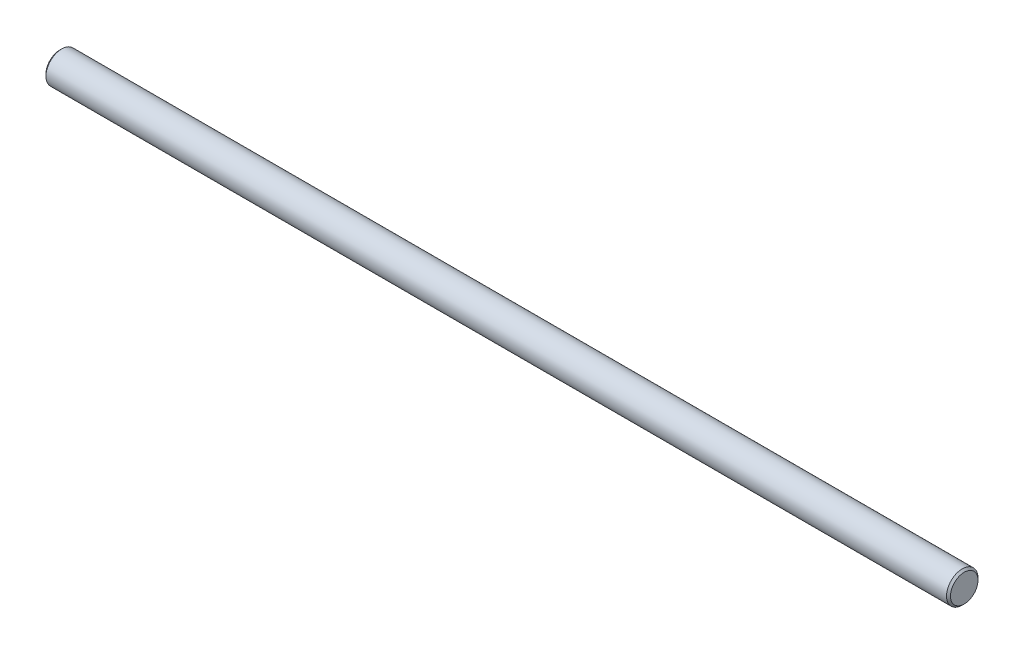
from build123d import *

# Parameters (mm, degrees)
SKETCH1_R           = 4
BOSS_EXTRUDE1_DEPTH = 115
CHAMFER1_SIZE       = 0.5


with BuildPart() as part:
    # Sketch1 → Boss-Extrude1 (new, symmetric)
    with BuildSketch(Plane(origin=(0, 0, 0), x_dir=(0, 0, -1), z_dir=(1, 0, 0))):
        Circle(SKETCH1_R)
    extrude(amount=BOSS_EXTRUDE1_DEPTH, both=True)

    # Chamfer1
    chamfer1_edges = [part.edges().sort_by_distance(p)[0] for p in [
        (-115, 0, 4),
        (115, 0, 4),
    ]]
    chamfer(chamfer1_edges, length=CHAMFER1_SIZE)


solid = part.part
